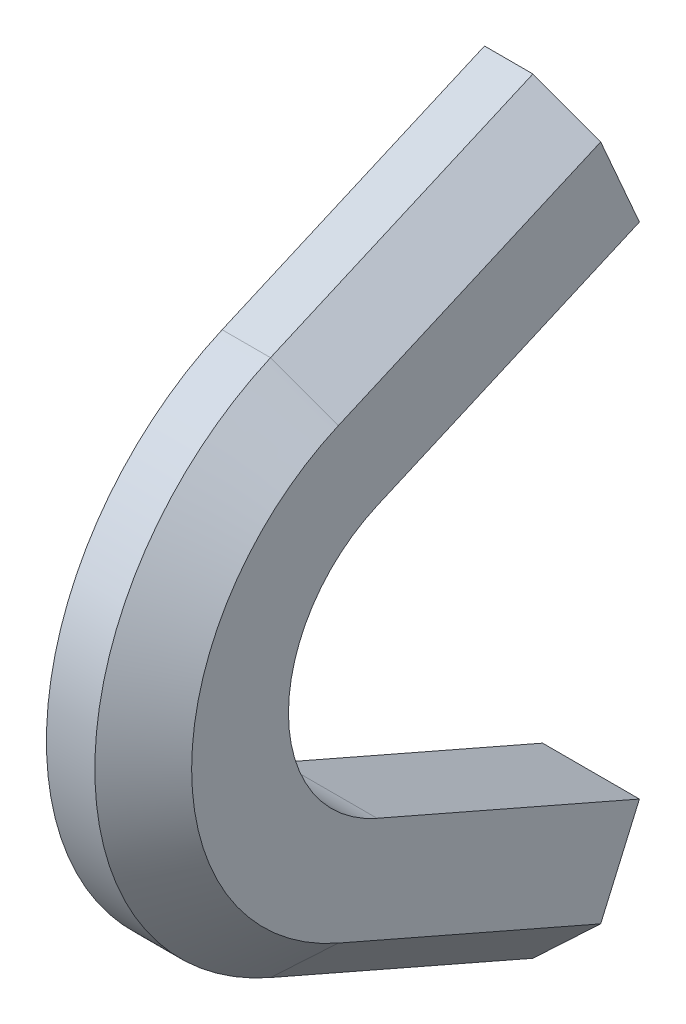
from build123d import *

# Parameters (mm, degrees)
EXTRUDE_1_DEPTH = 10
CHAMFER_1_SIZE  = 5


with BuildPart() as part:
    # 草图1 → 凸台-拉伸1 (new body)
    with BuildSketch(Plane.ZY):
        with BuildLine():
            Line((6.100444343, 13.976661934), (-21, 25.805291199))
            Line((-21, 25.805291199), (-14.999562941, 39.552827528))
            Line((-14.999562941, 39.552827528), (12.100881401, 27.724198263))
            ThreePointArc((12.100881401, 27.724198263), (30.25, 0), (12.100881401, -27.724198263))
            Line((12.100881401, -27.724198263), (-14.999562941, -39.552827528))
            Line((-14.999562941, -39.552827528), (-21, -25.805291199))
            Line((-21, -25.805291199), (6.100444343, -13.976661934))
            ThreePointArc((6.100444343, -13.976661934), (15.25, 0), (6.100444343, 13.976661934))
        make_face()
    extrude(amount=EXTRUDE_1_DEPTH)

    # 倒角1
    chamfer_1_edges = [part.edges().sort_by_distance(p)[0] for p in [
        (0, -33.638512895, -1.44934077),
        (0, 33.638512895, -1.44934077),
        (0, 0, 30.25),
    ]]
    chamfer(chamfer_1_edges, length=CHAMFER_1_SIZE)


solid = part.part
